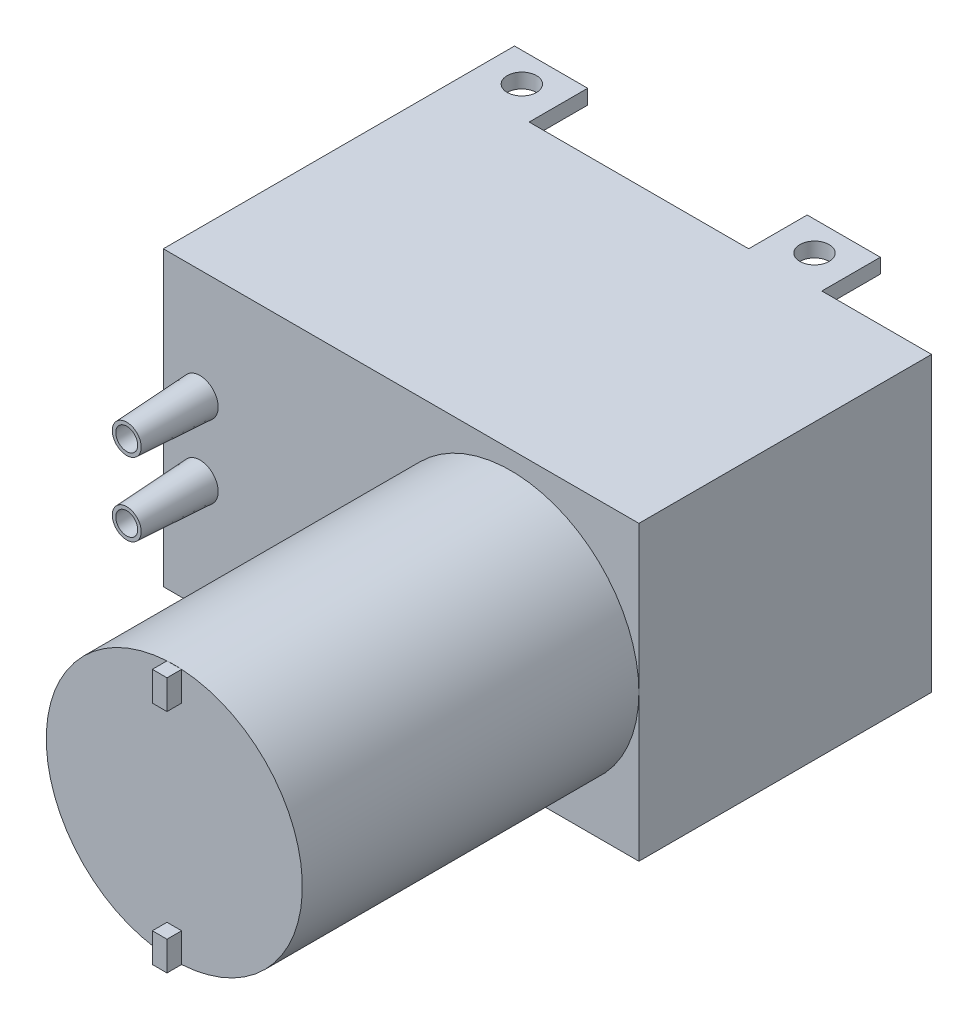
from build123d import *

# Parameters (mm, degrees)
ESQUISSE1_W                  = 65
ESQUISSE1_H                  = 40
BOSS_EXTRU_1_DEPTH           = 40
ESQUISSE2_W                  = 0.314102564
ESQUISSE2_H                  = 2.557692308
ENL_V_MAT_EXTRU_1_DEPTH      = 0.1
ESQUISSE3_R                  = 17.5
BOSS_EXTRU_2_DEPTH           = 46
ESQUISSE4_W                  = 2
ESQUISSE4_H                  = 4
BOSS_EXTRU_3_DEPTH           = 2
ESQUISSE5_R                  = 2.5
BOSS_EXTRU_4_DEPTH           = 10
BOSS_EXTRU_4_DRAFT           = 3
BOSS_EXTRU_4_PROFILE_2_DEPTH = 10
BOSS_EXTRU_4_PROFILE_2_DRAFT = 3
ESQUISSE6_R                  = 1.5
ENL_V_MAT_EXTRU_2_DEPTH      = 10
ESQUISSE7_W                  = 10
ESQUISSE7_H                  = 2
BOSS_EXTRU_5_DEPTH           = 8
ESQUISSE8_R                  = 2
ENL_V_MAT_EXTRU_3_DEPTH      = 90.29165706


with BuildPart() as part:
    # Esquisse1 → Boss.-Extru.1 (new body)
    with BuildSketch(Plane(origin=(0, 0, 0), x_dir=(1, 0, 0), z_dir=(0, 1, 0))):
        with Locations((32.5, 20)):
            Rectangle(ESQUISSE1_W, ESQUISSE1_H)
    extrude(amount=BOSS_EXTRU_1_DEPTH)

    # Esquisse2 → Enlèv. mat.-Extru.1 (cut)
    # profile 1 of 11: a face of its own
    with BuildSketch(Plane(origin=(0, 0, 0), x_dir=(1, 0, 0), z_dir=(0, 1, 0))):
        with BuildLine():
            Line((43.755423168, 24.312140482), (43.06902493, 24.312140482))
            add(Edge.make_bspline(
                [(43.06902493, 24.312140482), (43.021814024, 24.312088586), (42.931355832, 24.31198915), (42.801640776, 24.308974404), (42.683831044, 24.304947712), (42.578180663, 24.299365819), (42.484364565, 24.292769229), (42.402807266, 24.283517189), (42.332867709, 24.273856894), (42.29096126, 24.264035487), (42.27184945, 24.259556347)],
                knots=[0, 0, 0, 0, 1.415646017, 2.712440637, 3.8905458, 4.950247383, 5.884950622, 6.709939814, 7.411656543, 8, 8, 8, 8], degree=3))
            add(Edge.make_bspline(
                [(42.27184945, 24.259556347), (42.247655916, 24.252934398), (42.199838939, 24.239846536), (42.130937896, 24.213632812), (42.06538405, 24.182550647), (42.002952492, 24.147126707), (41.944410409, 24.105841143), (41.888884368, 24.060367525), (41.836864387, 24.009655957), (41.788642995, 23.954275217), (41.744358198, 23.895155007), (41.706228515, 23.831412777), (41.674301288, 23.764121474), (41.646918017, 23.693327903), (41.627209562, 23.618437579), (41.612362662, 23.539970867), (41.602939035, 23.457936177), (41.602036473, 23.401876309), (41.601577014, 23.373338399)],
                knots=[0, 0, 0, 0, 0.999701418, 1.975846123, 2.934577507, 3.890451536, 4.834027766, 5.787354733, 6.749476667, 7.726910423, 8.712836071, 9.690891519, 10.682875813, 11.679750201, 12.712814741, 13.765529915, 14.8625177, 16, 16, 16, 16], degree=3))
            add(Edge.make_bspline(
                [(41.601577014, 23.373338399), (41.601998439, 23.344560622), (41.602822984, 23.288254958), (41.61271927, 23.20588217), (41.626049461, 23.12716378), (41.646546514, 23.052274329), (41.673392187, 22.981658559), (41.70488424, 22.914237327), (41.74286777, 22.851157655), (41.7865126, 22.792190537), (41.835064194, 22.737280625), (41.888317132, 22.68682583), (41.946056425, 22.641121492), (42.008098573, 22.600065148), (42.075048422, 22.564608869), (42.145890575, 22.532851564), (42.221240792, 22.506180503), (42.273383306, 22.492150442), (42.299894321, 22.485017085)],
                knots=[0, 0, 0, 0, 1.121902311, 2.195077645, 3.232258892, 4.234102512, 5.217864754, 6.176164875, 7.132989551, 8.084763148, 9.034132444, 9.988522005, 10.94243251, 11.903244335, 12.886203696, 13.894208494, 14.929344452, 16, 16, 16, 16], degree=3))
            add(Edge.make_bspline(
                [(42.299894321, 22.485017085), (42.321821655, 22.480354103), (42.369876683, 22.470134909), (42.449019405, 22.458726452), (42.541164791, 22.448988852), (42.646187071, 22.441687714), (42.763991976, 22.435437346), (42.894643233, 22.430469252), (43.03839731, 22.427739398), (43.138668554, 22.427598605), (43.191020123, 22.427525097)],
                knots=[0, 0, 0, 0, 0.601384939, 1.31797006, 2.144135048, 3.087295005, 4.142315834, 5.309527816, 6.595305764, 8, 8, 8, 8], degree=3))
            Line((43.191020123, 22.427525097), (43.441320604, 22.427525097))
            Line((43.441320604, 22.427525097), (43.441320604, 20.812140482))
            Line((43.441320604, 20.812140482), (43.755423168, 20.812140482))
            Line((43.755423168, 20.812140482), (43.755423168, 24.312140482))
        make_face()
        with BuildLine():
            Line((43.441320604, 23.953166123), (43.441320604, 22.786499456))
            Line((43.441320604, 22.786499456), (42.828540155, 22.778787117))
            add(Edge.make_bspline(
                [(42.828540155, 22.778787117), (42.798620229, 22.778771653), (42.740860429, 22.778741801), (42.657424206, 22.782727024), (42.580014919, 22.787327557), (42.508870343, 22.79406348), (42.443958409, 22.803584738), (42.38517088, 22.813196476), (42.332963597, 22.827101838), (42.271864395, 22.845824908), (42.203781048, 22.877757523), (42.129713499, 22.924107413), (42.066942913, 22.983188122), (42.012624616, 23.049615953), (41.969518738, 23.123515082), (41.937962746, 23.202584019), (41.919421588, 23.286011869), (41.916935395, 23.343100007), (41.915679578, 23.371936155)],
                knots=[0, 0, 0, 0, 1.160613943, 2.240541288, 3.23993089, 4.169200891, 5.011653406, 5.7853311, 6.478053781, 7.106038997, 8.262395093, 9.384106736, 10.481365981, 11.59014053, 12.70357646, 13.786202915, 14.881775077, 16, 16, 16, 16], degree=3))
            add(Edge.make_bspline(
                [(41.915679578, 23.371936155), (41.916942224, 23.400074669), (41.919452209, 23.456010551), (41.938108073, 23.537989311), (41.969457386, 23.616225016), (42.012913981, 23.689198101), (42.065655111, 23.755386905), (42.126954454, 23.812884032), (42.196667715, 23.859105735), (42.261515946, 23.888939016), (42.319117132, 23.907154292), (42.369149092, 23.919899132), (42.425639767, 23.930074739), (42.488607546, 23.938314241), (42.55756438, 23.945367703), (42.633102695, 23.95015368), (42.714936338, 23.952955136), (42.771746909, 23.953094091), (42.801196405, 23.953166123)],
                knots=[0, 0, 0, 0, 1.120700087, 2.227813068, 3.331159281, 4.466773991, 5.599788987, 6.693661531, 7.80175334, 8.91857717, 9.525282508, 10.207424825, 10.974604443, 11.810962634, 12.737642355, 13.736264703, 14.826523623, 16, 16, 16, 16], degree=3))
            Line((42.801196405, 23.953166123), (43.441320604, 23.953166123))
        make_face(mode=Mode.SUBTRACT)
    # profile 2 of 11: a face of its own
    with BuildSketch(Plane(origin=(0, 0, 0), x_dir=(1, 0, 0), z_dir=(0, 1, 0))):
        with BuildLine():
            add(Edge.make_bspline(
                [(39.737995283, 23.414704585), (39.69000401, 23.413682693), (39.595904853, 23.411679015), (39.458096967, 23.390264049), (39.326551831, 23.357516685), (39.200765639, 23.312245123), (39.082349343, 23.251563172), (38.969578099, 23.179153881), (38.86276109, 23.093371287), (38.798738061, 23.027013219), (38.766240475, 22.993330386)],
                knots=[0, 0, 0, 0, 1.054011418, 2.066658804, 3.057071809, 4.030435133, 4.997543892, 5.974964718, 6.972108034, 8, 8, 8, 8], degree=3))
            add(Edge.make_bspline(
                [(38.766240475, 22.993330386), (38.738258521, 22.9611164), (38.682836141, 22.897311858), (38.611770422, 22.793856245), (38.550548862, 22.686716144), (38.501485901, 22.574468818), (38.462800877, 22.458094146), (38.435335181, 22.337192135), (38.418998246, 22.212029788), (38.416795279, 22.12702595), (38.415679578, 22.083975418)],
                knots=[0, 0, 0, 0, 1.025258237, 2.030674902, 3.01204498, 3.988269485, 4.97094183, 5.956517959, 6.965070386, 8, 8, 8, 8], degree=3))
            add(Edge.make_bspline(
                [(38.415679578, 22.083975418), (38.416660915, 22.04067536), (38.418600084, 21.955112427), (38.4369437, 21.829093061), (38.465474786, 21.706898238), (38.506306624, 21.589039545), (38.558664733, 21.475156717), (38.622555421, 21.365747168), (38.698427038, 21.260595035), (38.784431035, 21.160593196), (38.879482911, 21.068426982), (38.982599059, 20.988098712), (39.091753093, 20.919277188), (39.208396446, 20.863840772), (39.331463933, 20.820131072), (39.461221001, 20.789431055), (39.597466071, 20.770869372), (39.690493293, 20.768485798), (39.737995283, 20.767268687)],
                knots=[0, 0, 0, 0, 0.998656419, 1.973391657, 2.932242238, 3.890759089, 4.846373663, 5.82037756, 6.809684879, 7.83454468, 8.860553229, 9.859544525, 10.845671541, 11.83227036, 12.833544569, 13.85385346, 14.904124723, 16, 16, 16, 16], degree=3))
            add(Edge.make_bspline(
                [(39.737995283, 20.767268687), (39.785730003, 20.768489883), (39.879220862, 20.770881658), (40.015946844, 20.789358941), (40.145936463, 20.820116923), (40.269165062, 20.863984416), (40.386309909, 20.91927896), (40.496096406, 20.987890649), (40.599296321, 21.068450804), (40.694368305, 21.160586741), (40.780366911, 21.260596698), (40.856239919, 21.365746736), (40.920130245, 21.47515683), (40.972488449, 21.589039515), (41.013320262, 21.706898246), (41.041851355, 21.829093059), (41.060194969, 21.955112427), (41.062134138, 22.04067536), (41.063115475, 22.083975418)],
                knots=[0, 0, 0, 0, 1.099876186, 2.154163076, 3.173186993, 4.173200201, 5.163417411, 6.152872554, 7.150605724, 8.17532212, 9.198891216, 10.186952605, 11.159729845, 12.11414092, 13.071450619, 14.029093627, 15.002601286, 16, 16, 16, 16], degree=3))
            add(Edge.make_bspline(
                [(41.063115475, 22.083975418), (41.061992165, 22.126791964), (41.059768204, 22.211561366), (41.043447694, 22.336488427), (41.016089138, 22.457185816), (40.977357742, 22.573111292), (40.927842551, 22.684866728), (40.867481263, 22.792271559), (40.79569063, 22.895259359), (40.740488679, 22.958981439), (40.712554578, 22.99122702)],
                knots=[0, 0, 0, 0, 1.031353054, 2.041901799, 3.029428768, 4.008703097, 4.981709435, 5.96992636, 6.972712378, 8, 8, 8, 8], degree=3))
            add(Edge.make_bspline(
                [(40.712554578, 22.99122702), (40.680105987, 23.02520196), (40.616290123, 23.092019656), (40.508941395, 23.17755218), (40.396447574, 23.251468254), (40.276722648, 23.310944469), (40.15103979, 23.357782987), (40.018820548, 23.390348502), (39.880545032, 23.411601857), (39.785985411, 23.413660035), (39.737995283, 23.414704585)],
                knots=[0, 0, 0, 0, 1.027980169, 2.021703884, 2.998553061, 3.971491411, 4.943284454, 5.930300938, 6.949603206, 8, 8, 8, 8], degree=3))
        make_face()
        with BuildLine():
            add(Edge.make_bspline(
                [(39.739397527, 23.10060202), (39.773335138, 23.099637429), (39.840334267, 23.097733146), (39.938953851, 23.083249241), (40.033894005, 23.060301737), (40.125334849, 23.027697681), (40.212968022, 22.985598782), (40.296877424, 22.933890422), (40.377309864, 22.873257466), (40.452691927, 22.803794794), (40.52187424, 22.727915799), (40.582352216, 22.647067441), (40.633777323, 22.562561094), (40.676617482, 22.474308883), (40.70852467, 22.381416469), (40.731697692, 22.284935838), (40.746167933, 22.184670422), (40.748054311, 22.116509403), (40.749012911, 22.081872052)],
                knots=[0, 0, 0, 0, 1.021534396, 2.016698045, 2.994645724, 3.958388632, 4.93408049, 5.916473867, 6.921342795, 7.962252576, 8.998418191, 10.008913653, 10.997312074, 11.973003931, 12.956656626, 13.948281152, 14.957379055, 16, 16, 16, 16], degree=3))
            add(Edge.make_bspline(
                [(40.749012911, 22.081872052), (40.747406088, 22.037120025), (40.744216843, 21.94829562), (40.718281607, 21.817484497), (40.674895327, 21.691902645), (40.616308047, 21.572286259), (40.542901828, 21.461613981), (40.456414762, 21.362942497), (40.357775061, 21.277756685), (40.248158561, 21.20707584), (40.129804243, 21.150916084), (40.004547922, 21.111117108), (39.873907228, 21.085245416), (39.784626497, 21.082673941), (39.739397527, 21.081371251)],
                knots=[0, 0, 0, 0, 1.016792936, 2.018143844, 3.017858371, 4.030088057, 5.03801393, 6.028138512, 7.003788237, 7.991172063, 8.984598303, 9.972568034, 10.972917682, 12, 12, 12, 12], degree=3))
            add(Edge.make_bspline(
                [(39.739397527, 21.081371251), (39.694171158, 21.082681531), (39.604895562, 21.085267988), (39.474436385, 21.110986808), (39.349522413, 21.151090469), (39.231291025, 21.207012679), (39.121724422, 21.278025093), (39.022375301, 21.36246147), (38.93662669, 21.461875322), (38.863293085, 21.572432851), (38.803746342, 21.691717203), (38.76056314, 21.817507675), (38.734565554, 21.948289717), (38.731384726, 22.037118048), (38.729782142, 22.081872052)],
                knots=[0, 0, 0, 0, 1.02726834, 2.027799167, 3.010890988, 4.004497153, 4.992059811, 5.971914811, 6.958719428, 7.966827853, 8.981595046, 9.981490638, 10.983022906, 12, 12, 12, 12], degree=3))
            add(Edge.make_bspline(
                [(38.729782142, 22.081872052), (38.730740412, 22.11650961), (38.732626141, 22.184671036), (38.747101106, 22.284933489), (38.770256645, 22.381425086), (38.802228262, 22.474277089), (38.844882276, 22.562789594), (38.897299069, 22.646819321), (38.957530095, 22.728195867), (39.027547216, 22.803549508), (39.102850594, 22.873284544), (39.183315632, 22.933913934), (39.26710061, 22.985371529), (39.354479193, 23.02805777), (39.445931761, 23.06000511), (39.54073889, 23.083381741), (39.6389377, 23.097671938), (39.705696743, 23.09961908), (39.739397527, 23.10060202)],
                knots=[0, 0, 0, 0, 1.042956736, 2.052379634, 3.044323526, 4.02829302, 5.004299113, 5.996692471, 7.007513377, 8.048758398, 9.090003419, 10.095195979, 11.07790575, 12.047570684, 13.018257071, 13.989683339, 14.985167495, 16, 16, 16, 16], degree=3))
        make_face(mode=Mode.SUBTRACT)
    # profile 3 of 11: a face of its own
    with BuildSketch(Plane(origin=(0, 0, 0), x_dir=(1, 0, 0), z_dir=(0, 1, 0))):
        with BuildLine():
            Line((37.78747445, 23.36983279), (37.473371886, 23.36983279))
            Line((37.473371886, 23.36983279), (37.473371886, 22.925321572))
            add(Edge.make_bspline(
                [(37.473371886, 22.925321572), (37.445087936, 22.964209173), (37.390893176, 23.038721547), (37.302027524, 23.136911831), (37.213251411, 23.220239985), (37.149318029, 23.263982857), (37.118604257, 23.284997052)],
                knots=[0, 0, 0, 0, 1.134379233, 2.173579362, 3.122582517, 4, 4, 4, 4], degree=3))
            add(Edge.make_bspline(
                [(37.118604257, 23.284997052), (37.076739595, 23.305002418), (36.993741695, 23.344663631), (36.862322471, 23.38489719), (36.727847801, 23.409622291), (36.637039587, 23.413003665), (36.591360668, 23.414704585)],
                knots=[0, 0, 0, 0, 1.014936303, 2.012140481, 3.000054389, 4, 4, 4, 4], degree=3))
            add(Edge.make_bspline(
                [(36.591360668, 23.414704585), (36.560467671, 23.413659294), (36.499332092, 23.41159072), (36.408748002, 23.398130684), (36.32088939, 23.374864511), (36.236275361, 23.342457187), (36.156554682, 23.3032105), (36.083465484, 23.257160793), (36.017841276, 23.205463717), (35.959715224, 23.145784784), (35.907446199, 23.076448186), (35.859367352, 22.995583937), (35.81494214, 22.901376276), (35.790320831, 22.833009735), (35.777358264, 22.797016283)],
                knots=[0, 0, 0, 0, 1.009824226, 1.998387844, 2.986035974, 3.974953746, 4.955485308, 5.885931332, 6.793869504, 7.679848016, 8.601185859, 9.625726857, 10.749998409, 12, 12, 12, 12], degree=3))
            add(Edge.make_bspline(
                [(35.777358264, 22.797016283), (35.763647012, 22.821740703), (35.736665195, 22.870394887), (35.691359558, 22.93925315), (35.643891762, 23.003659942), (35.593857269, 23.063666366), (35.541432682, 23.118976096), (35.486371282, 23.169771998), (35.4289865, 23.216272212), (35.34919426, 23.270595371), (35.245381653, 23.328296553), (35.114493538, 23.378324997), (34.978343367, 23.409241125), (34.885925668, 23.412871398), (34.839257302, 23.414704585)],
                knots=[0, 0, 0, 0, 0.86119277, 1.694706429, 2.50939023, 3.298075842, 4.073795165, 4.829715201, 5.57930267, 6.321991688, 7.768977793, 9.186738141, 10.579381044, 12, 12, 12, 12], degree=3))
            add(Edge.make_bspline(
                [(34.839257302, 23.414704585), (34.796375839, 23.413087364), (34.712452653, 23.409922305), (34.590275387, 23.385068832), (34.476333582, 23.342391185), (34.370856506, 23.284157548), (34.275696693, 23.210978365), (34.192980383, 23.123909527), (34.12321002, 23.023566904), (34.07763138, 22.929174916), (34.046716116, 22.845839583), (34.027654882, 22.774833292), (34.010815187, 22.696681739), (33.996833941, 22.611291477), (33.986615389, 22.518360869), (33.979044674, 22.418041993), (33.9739206, 22.310256881), (33.973558528, 22.235891381), (33.973371886, 22.197557149)],
                knots=[0, 0, 0, 0, 1.209669288, 2.367440248, 3.500751976, 4.631527125, 5.755587489, 6.87532382, 8.007944318, 9.190864318, 9.82315674, 10.514484317, 11.263564316, 12.079023757, 12.955305781, 13.901327259, 14.918167583, 16, 16, 16, 16], degree=3))
            Line((33.973371886, 22.197557149), (33.973371886, 20.812140482))
            Line((33.973371886, 20.812140482), (34.28747445, 20.812140482))
            Line((34.28747445, 20.812140482), (34.28747445, 22.198959392))
            add(Edge.make_bspline(
                [(34.28747445, 22.198959392), (34.287552333, 22.231679966), (34.287702012, 22.294563933), (34.290395643, 22.384816384), (34.295470958, 22.467084741), (34.301405596, 22.54125683), (34.309649406, 22.607505618), (34.320295337, 22.665698037), (34.331573017, 22.716291848), (34.350309008, 22.772377896), (34.3802569, 22.834248106), (34.42587438, 22.900971682), (34.483344486, 22.959052482), (34.549704643, 23.009470799), (34.625253088, 23.05046444), (34.708517811, 23.07974045), (34.798981862, 23.097863328), (34.861604651, 23.099669344), (34.893944802, 23.10060202)],
                knots=[0, 0, 0, 0, 1.253487763, 2.409012846, 3.458416907, 4.410876679, 5.259312806, 6.014470957, 6.676830364, 7.243083969, 8.276244668, 9.299465089, 10.325150304, 11.392391894, 12.482080715, 13.603491619, 14.762376348, 16, 16, 16, 16], degree=3))
            add(Edge.make_bspline(
                [(34.893944802, 23.10060202), (34.933614757, 23.099185863), (35.012017668, 23.096386998), (35.126463154, 23.067813125), (35.236434171, 23.024732874), (35.338649304, 22.962300417), (35.432677094, 22.887492053), (35.513576672, 22.798542457), (35.580408858, 22.69791253), (35.625662834, 22.604765828), (35.654252135, 22.521096384), (35.673129051, 22.447999012), (35.687812442, 22.364917444), (35.701582971, 22.272409953), (35.710570699, 22.169839773), (35.718739072, 22.057681372), (35.722559934, 21.935597413), (35.723094393, 21.850970724), (35.723371886, 21.807032309)],
                knots=[0, 0, 0, 0, 1.090531906, 2.155305635, 3.229839962, 4.33261226, 5.44038871, 6.529323825, 7.629011124, 8.757537029, 9.370236727, 10.061839251, 10.834451254, 11.692844982, 12.636905849, 13.66920014, 14.789842145, 16, 16, 16, 16], degree=3))
            Line((35.723371886, 21.807032309), (35.723371886, 20.812140482))
            Line((35.723371886, 20.812140482), (36.03747445, 20.812140482))
            Line((36.03747445, 20.812140482), (36.03747445, 22.112721411))
            add(Edge.make_bspline(
                [(36.03747445, 22.112721411), (36.037553881, 22.14941473), (36.037706698, 22.220008987), (36.040383015, 22.321242663), (36.045469637, 22.413323743), (36.051350185, 22.496145207), (36.059810364, 22.569556535), (36.069420126, 22.633951293), (36.080768736, 22.689168044), (36.099558621, 22.749731429), (36.128273089, 22.816452352), (36.174461351, 22.887593374), (36.232068932, 22.949861471), (36.299639808, 23.003020219), (36.37564549, 23.046961701), (36.459628891, 23.078621453), (36.550833803, 23.097045742), (36.613711509, 23.099394239), (36.646048168, 23.10060202)],
                knots=[0, 0, 0, 0, 1.320475261, 2.540461679, 3.643808994, 4.639130445, 5.527981419, 6.302341397, 6.981980563, 7.553956391, 8.582137848, 9.585246428, 10.591171744, 11.620968678, 12.668337649, 13.738356861, 14.836885341, 16, 16, 16, 16], degree=3))
            add(Edge.make_bspline(
                [(36.646048168, 23.10060202), (36.684064379, 23.09907156), (36.759829339, 23.096021408), (36.871131308, 23.068567134), (36.978616992, 23.025563059), (37.080571691, 22.96590324), (37.174245839, 22.892004162), (37.256254106, 22.805089266), (37.325196632, 22.706240232), (37.370928447, 22.614075716), (37.400426921, 22.532502441), (37.420022255, 22.463151493), (37.436861881, 22.386151245), (37.449375903, 22.301264134), (37.461456319, 22.20904304), (37.467286628, 22.10902855), (37.47295819, 22.001306462), (37.473230604, 21.926933917), (37.473371886, 21.888362437)],
                knots=[0, 0, 0, 0, 1.098833095, 2.189935336, 3.297829714, 4.440610912, 5.596351641, 6.740013378, 7.886572111, 9.072425424, 9.705826452, 10.395263256, 11.156850408, 11.985370555, 12.878090359, 13.847760091, 14.883794034, 16, 16, 16, 16], degree=3))
            Line((37.473371886, 21.888362437), (37.473371886, 20.812140482))
            Line((37.473371886, 20.812140482), (37.78747445, 20.812140482))
            Line((37.78747445, 20.812140482), (37.78747445, 23.36983279))
        make_face()
    # profile 4 of 11: a face of its own
    with BuildSketch(Plane(origin=(0, 0, 0), x_dir=(1, 0, 0), z_dir=(0, 1, 0))):
        with BuildLine():
            Line((33.255423168, 23.36983279), (32.941320604, 23.36983279))
            Line((32.941320604, 23.36983279), (32.941320604, 22.896575578))
            add(Edge.make_bspline(
                [(32.941320604, 22.896575578), (32.907963119, 22.939513312), (32.843139525, 23.022954205), (32.73141462, 23.130944333), (32.613487811, 23.222019637), (32.486324399, 23.29340217), (32.351900708, 23.347222982), (32.210768391, 23.387002432), (32.061729626, 23.410443906), (31.959833173, 23.413265568), (31.907867078, 23.414704585)],
                knots=[0, 0, 0, 0, 1.0828784, 2.104357462, 3.088488658, 4.04616522, 5.001424249, 5.969181776, 6.964304535, 8, 8, 8, 8], degree=3))
            add(Edge.make_bspline(
                [(31.907867078, 23.414704585), (31.862475475, 23.413391406), (31.772756586, 23.410795839), (31.640693357, 23.393222784), (31.513517974, 23.363105092), (31.39194992, 23.319704176), (31.274686855, 23.266048706), (31.163464755, 23.198331671), (31.056551199, 23.11992548), (30.95663501, 23.029693329), (30.864313643, 22.932065063), (30.784467462, 22.827042759), (30.715595557, 22.718080172), (30.659925261, 22.60348808), (30.616316913, 22.48416885), (30.585302236, 22.359640409), (30.566844592, 22.230364469), (30.564368141, 22.142461748), (30.563115475, 22.097997854)],
                knots=[0, 0, 0, 0, 1.041296284, 2.058176809, 3.050446431, 4.034000596, 5.01514041, 6.003636468, 7.015969324, 8.052561599, 9.08815499, 10.094063707, 11.074456064, 12.040834395, 13.011057502, 13.983766392, 14.980127149, 16, 16, 16, 16], degree=3))
            add(Edge.make_bspline(
                [(30.563115475, 22.097997854), (30.564340961, 22.052595545), (30.566757795, 21.963055641), (30.585502801, 21.831568543), (30.615459675, 21.70508117), (30.658517858, 21.583803906), (30.714159347, 21.467820255), (30.781863907, 21.357213859), (30.861750374, 21.252020156), (30.953051502, 21.153667256), (31.052104438, 21.063067943), (31.157981928, 20.983829873), (31.269040853, 20.917288498), (31.38471302, 20.861705538), (31.505988659, 20.819813354), (31.632301936, 20.789595553), (31.763584083, 20.770961058), (31.852885235, 20.768508915), (31.898051373, 20.767268687)],
                knots=[0, 0, 0, 0, 1.038740735, 2.04854663, 3.033179607, 4.009277356, 4.987731542, 5.972001279, 6.972200261, 8.005528982, 9.039189865, 10.040446548, 11.026516639, 11.997840187, 12.972163198, 13.956796175, 14.96660207, 16, 16, 16, 16], degree=3))
            add(Edge.make_bspline(
                [(31.898051373, 20.767268687), (31.948878945, 20.768563495), (32.049278301, 20.77112112), (32.196075971, 20.79704053), (32.337352823, 20.835777465), (32.471543648, 20.892476459), (32.59971146, 20.964731975), (32.721131266, 21.052842181), (32.836448019, 21.156622806), (32.905856776, 21.235354622), (32.941320604, 21.275581988)],
                knots=[0, 0, 0, 0, 1.014726462, 2.004382257, 2.969841629, 3.936926163, 4.907207904, 5.903978561, 6.929055279, 8, 8, 8, 8], degree=3))
            Line((32.941320604, 21.275581988), (32.941320604, 19.86983279))
            Line((32.941320604, 19.86983279), (33.255423168, 19.86983279))
            Line((33.255423168, 19.86983279), (33.255423168, 23.36983279))
        make_face()
        with BuildLine():
            add(Edge.make_bspline(
                [(31.910671565, 23.10060202), (31.946251128, 23.099961762), (32.016298115, 23.098701259), (32.118970334, 23.08372731), (32.217865762, 23.061989569), (32.311987713, 23.029077669), (32.40223833, 22.988678855), (32.487922495, 22.938196844), (32.568980062, 22.878544838), (32.645207093, 22.810865494), (32.714070386, 22.736290806), (32.775033314, 22.656702997), (32.826240619, 22.572202858), (32.868742639, 22.483577495), (32.901085922, 22.39013221), (32.924041642, 22.292399197), (32.938471995, 22.190271485), (32.940360932, 22.120715478), (32.941320604, 22.085377661)],
                knots=[0, 0, 0, 0, 1.05670511, 2.080379991, 3.077984906, 4.06214886, 5.038337365, 6.01289324, 7.01187578, 8.025460281, 9.038092164, 10.024533457, 11.000252242, 11.969694649, 12.940728589, 13.933144304, 14.949937299, 16, 16, 16, 16], degree=3))
            add(Edge.make_bspline(
                [(32.941320604, 22.085377661), (32.939729747, 22.038989549), (32.936613126, 21.948111308), (32.911275758, 21.815327186), (32.870040494, 21.68967553), (32.81151178, 21.572214493), (32.737564206, 21.464231658), (32.648466049, 21.367541052), (32.545023498, 21.282750461), (32.428956307, 21.211329207), (32.304534176, 21.153341141), (32.174748264, 21.11182693), (32.041383383, 21.086254702), (31.951215063, 21.083007883), (31.905763713, 21.081371251)],
                knots=[0, 0, 0, 0, 1.03728447, 2.032128127, 3.01272805, 3.987917167, 4.958271349, 5.931593992, 6.91984656, 7.941419022, 8.973179163, 9.983609215, 10.983593296, 12, 12, 12, 12], degree=3))
            add(Edge.make_bspline(
                [(31.905763713, 21.081371251), (31.861227945, 21.082927628), (31.772832452, 21.086016756), (31.64267433, 21.112754944), (31.516183692, 21.153599969), (31.396003519, 21.213159525), (31.283180031, 21.286149583), (31.181298478, 21.373709616), (31.092291564, 21.475199559), (31.016427209, 21.588208062), (30.955295724, 21.709383446), (30.909365484, 21.834764835), (30.882856911, 21.963910258), (30.879100122, 22.050907971), (30.877218039, 22.094492245)],
                knots=[0, 0, 0, 0, 1.00104056, 1.986885549, 2.97790532, 3.984399681, 4.995088187, 5.994304198, 6.996462723, 8.023150851, 9.048424203, 10.043036403, 11.019596776, 12, 12, 12, 12], degree=3))
            add(Edge.make_bspline(
                [(30.877218039, 22.094492245), (30.878672773, 22.138347234), (30.881570907, 22.225715538), (30.910117945, 22.354478441), (30.953017923, 22.480366417), (31.015576974, 22.599886966), (31.089778244, 22.712661049), (31.179525241, 22.812214928), (31.280141437, 22.899385601), (31.392830601, 22.971401011), (31.513771027, 23.028686506), (31.641085943, 23.070570145), (31.774129545, 23.095743894), (31.8647572, 23.0989684), (31.910671565, 23.10060202)],
                knots=[0, 0, 0, 0, 0.983928682, 1.960191568, 2.949917689, 3.96440592, 4.982380491, 5.975291189, 6.965713506, 7.964880129, 8.970154049, 9.96478489, 10.968906225, 12, 12, 12, 12], degree=3))
        make_face(mode=Mode.SUBTRACT)
    # profile 5 of 11: a face of its own
    with BuildSketch(Plane(origin=(0, 0, 0), x_dir=(1, 0, 0), z_dir=(0, 1, 0))):
        with BuildLine():
            Line((27.835751693, 21.61983279), (27.556705219, 21.473298335))
            add(Edge.make_bspline(
                [(27.556705219, 21.473298335), (27.578941814, 21.433855003), (27.622205423, 21.3571139), (27.696606171, 21.25168204), (27.774598243, 21.156834324), (27.859702211, 21.07510467), (27.94937189, 21.003853285), (28.044104545, 20.94151546), (28.144393363, 20.88839694), (28.250243087, 20.843644412), (28.362542639, 20.809234918), (28.481564155, 20.784930697), (28.60753565, 20.769907428), (28.69388183, 20.768162287), (28.738095443, 20.767268687)],
                knots=[0, 0, 0, 0, 1.120438281, 2.179929193, 3.190490725, 4.156257408, 5.095198341, 6.022838206, 6.959905092, 7.901321166, 8.864066838, 9.862729781, 10.905609505, 12, 12, 12, 12], degree=3))
            add(Edge.make_bspline(
                [(28.738095443, 20.767268687), (28.787237421, 20.768415862), (28.883099182, 20.770653669), (29.02263893, 20.789946134), (29.154018348, 20.821418492), (29.277230051, 20.865384034), (29.391972304, 20.922811358), (29.498473159, 20.99277084), (29.597292685, 21.074903094), (29.685316894, 21.169919538), (29.764560777, 21.271601495), (29.834486596, 21.37755738), (29.892944028, 21.487520604), (29.940496638, 21.600791128), (29.978901503, 21.716655022), (30.005668206, 21.836166489), (30.021097954, 21.959002074), (30.0234624, 22.042099409), (30.024653937, 22.083975418)],
                knots=[0, 0, 0, 0, 1.145258523, 2.234067595, 3.276747158, 4.290159414, 5.277019952, 6.260822364, 7.254936242, 8.264827045, 9.274100331, 10.257902744, 11.220704747, 12.172965371, 13.118907548, 14.062713208, 15.023725156, 16, 16, 16, 16], degree=3))
            add(Edge.make_bspline(
                [(30.024653937, 22.083975418), (30.023594796, 22.123270248), (30.021495717, 22.201147413), (30.00826493, 22.316412958), (29.984816637, 22.42844141), (29.952640313, 22.537325858), (29.911089067, 22.642883992), (29.860256847, 22.745180056), (29.80006447, 22.844105195), (29.753591796, 22.906508329), (29.730182783, 22.937941764)],
                knots=[0, 0, 0, 0, 1.024358464, 2.0301432, 3.019427413, 4.004406732, 4.986367066, 5.972626655, 6.978780325, 8, 8, 8, 8], degree=3))
            add(Edge.make_bspline(
                [(29.730182783, 22.937941764), (29.6984751, 22.975810634), (29.636064154, 23.050348785), (29.530507798, 23.14828711), (29.416207602, 23.230330886), (29.294595976, 23.298338022), (29.164259502, 23.350011669), (29.026950211, 23.388519251), (28.881104625, 23.410097262), (28.781399404, 23.413145096), (28.730383104, 23.414704585)],
                knots=[0, 0, 0, 0, 1.030682036, 2.02871468, 2.997146059, 3.962720338, 4.930598197, 5.918074684, 6.934738563, 8, 8, 8, 8], degree=3))
            add(Edge.make_bspline(
                [(28.730383104, 23.414704585), (28.677935498, 23.413350536), (28.575045252, 23.4106942), (28.425013131, 23.386067867), (28.283052415, 23.347015312), (28.14921991, 23.291861522), (28.02350205, 23.22070197), (27.906716, 23.132560129), (27.796864488, 23.030142041), (27.732955909, 22.951378832), (27.700435187, 22.911299136)],
                knots=[0, 0, 0, 0, 1.056321875, 2.072262726, 3.055038591, 4.01806755, 4.982017516, 5.957941055, 6.960871419, 8, 8, 8, 8], degree=3))
            add(Edge.make_bspline(
                [(27.700435187, 22.911299136), (27.678308249, 22.881095554), (27.634201655, 22.820889436), (27.578954555, 22.722718279), (27.53099716, 22.620007684), (27.492664199, 22.511097387), (27.461624698, 22.397277807), (27.43916788, 22.277735262), (27.425998261, 22.152505351), (27.423409564, 22.067178795), (27.422089834, 22.023678944)],
                knots=[0, 0, 0, 0, 0.94817472, 1.890038105, 2.849395472, 3.817997239, 4.812318967, 5.836947057, 6.897266129, 8, 8, 8, 8], degree=3))
            Line((27.422089834, 22.023678944), (29.710551373, 22.023678944))
            add(Edge.make_bspline(
                [(29.710551373, 22.023678944), (29.709011766, 21.989978479), (29.705984192, 21.923707876), (29.691869049, 21.826737092), (29.669620275, 21.73436375), (29.638351213, 21.647280708), (29.600484368, 21.564350581), (29.554098651, 21.486188544), (29.498759097, 21.413150614), (29.437033397, 21.344583476), (29.368326302, 21.283522715), (29.296043555, 21.228870939), (29.21914999, 21.183065342), (29.138251906, 21.145885452), (29.053480121, 21.116779136), (28.964807926, 21.096911316), (28.87240981, 21.083604209), (28.809424076, 21.082124543), (28.777358264, 21.081371251)],
                knots=[0, 0, 0, 0, 1.094153842, 2.151609401, 3.174256925, 4.172055639, 5.149267565, 6.128595816, 7.11444997, 8.118368179, 9.117203808, 10.09244225, 11.054858984, 12.015122123, 12.976791628, 13.957293641, 14.960065497, 16, 16, 16, 16], degree=3))
            add(Edge.make_bspline(
                [(28.777358264, 21.081371251), (28.746007116, 21.081979308), (28.683800425, 21.083185809), (28.591159568, 21.09491772), (28.500020041, 21.113887995), (28.410759057, 21.139777986), (28.325188211, 21.171354838), (28.245942661, 21.209457695), (28.173062446, 21.251607442), (28.104945479, 21.299817117), (28.038874486, 21.358825304), (27.973331999, 21.432461025), (27.903055346, 21.519548553), (27.859065753, 21.585094219), (27.835751693, 21.61983279)],
                knots=[0, 0, 0, 0, 0.99110716, 1.966546729, 2.947904876, 3.932708344, 4.903319531, 5.828989031, 6.710028674, 7.56322171, 8.463672341, 9.504779593, 10.677557249, 12, 12, 12, 12], degree=3))
        make_face()
        with BuildLine():
            add(Edge.make_bspline(
                [(27.736192398, 22.337781508), (27.747689023, 22.379444381), (27.769816324, 22.459632002), (27.816052689, 22.570672892), (27.86812423, 22.669360793), (27.929745961, 22.754940426), (27.999564687, 22.830943939), (28.080209869, 22.897362525), (28.170645763, 22.956779976), (28.270404903, 23.006932475), (28.376046688, 23.049622334), (28.48665288, 23.07824745), (28.599510668, 23.097856992), (28.675844955, 23.0996831), (28.714257302, 23.10060202)],
                knots=[0, 0, 0, 0, 1.154881502, 2.222775134, 3.210006277, 4.132804581, 5.035138423, 5.962687519, 6.919655026, 7.923214229, 8.944639381, 9.960483929, 10.97369054, 12, 12, 12, 12], degree=3))
            add(Edge.make_bspline(
                [(28.714257302, 23.10060202), (28.745606741, 23.099990349), (28.80757799, 23.098781203), (28.898879058, 23.087311074), (28.986558757, 23.068351229), (29.071264045, 23.042386272), (29.151884913, 23.00777767), (29.230079681, 22.967194443), (29.303860077, 22.917652859), (29.350001373, 22.879894004), (29.373311789, 22.860818367)],
                knots=[0, 0, 0, 0, 1.04873581, 2.073130211, 3.073294108, 4.04793562, 5.032784715, 6.005352987, 6.992311501, 8, 8, 8, 8], degree=3))
            add(Edge.make_bspline(
                [(29.373311789, 22.860818367), (29.390005071, 22.845724051), (29.423788206, 22.815176835), (29.468928727, 22.762547628), (29.5121492, 22.705796066), (29.551482853, 22.642750942), (29.587560439, 22.574130163), (29.621320416, 22.500512527), (29.651706828, 22.421339397), (29.668802938, 22.366166958), (29.677598648, 22.337781508)],
                knots=[0, 0, 0, 0, 0.879870761, 1.780643979, 2.707998968, 3.669668524, 4.684282772, 5.740141944, 6.837334558, 8, 8, 8, 8], degree=3))
            Line((29.677598648, 22.337781508), (27.736192398, 22.337781508))
        make_face(mode=Mode.SUBTRACT)
    # profile 6 of 11: a face of its own
    with BuildSketch(Plane(origin=(0, 0, 0), x_dir=(1, 0, 0), z_dir=(0, 1, 0))):
        with BuildLine():
            Line((22.845166757, 23.36983279), (22.845166757, 20.812140482))
            Line((22.845166757, 20.812140482), (23.159269321, 20.812140482))
            Line((23.159269321, 20.812140482), (23.159269321, 21.254548335))
            add(Edge.make_bspline(
                [(23.159269321, 21.254548335), (23.194688112, 21.214508741), (23.263808327, 21.136370969), (23.379249445, 21.034288797), (23.501617623, 20.949910475), (23.630318944, 20.88176056), (23.765237188, 20.830568503), (23.906073275, 20.794182344), (24.052884656, 20.770788509), (24.153137011, 20.768452487), (24.203940796, 20.767268687)],
                knots=[0, 0, 0, 0, 1.074387032, 2.096679803, 3.090159297, 4.057316773, 5.018401886, 5.985159533, 6.978961417, 8, 8, 8, 8], degree=3))
            add(Edge.make_bspline(
                [(24.203940796, 20.767268687), (24.24910875, 20.768495059), (24.338181955, 20.77091352), (24.469211032, 20.789675823), (24.595303281, 20.819806445), (24.716577854, 20.861707335), (24.832249999, 20.917288156), (24.943310096, 20.983829404), (25.049182788, 21.063070234), (25.148254327, 21.153658263), (25.239486327, 21.25205325), (25.3195476, 21.356998797), (25.38630068, 21.468041101), (25.44212076, 21.583774254), (25.485117105, 21.705089174), (25.515090739, 21.831566342), (25.533831186, 21.963056216), (25.536248647, 22.052595739), (25.53747445, 22.097997854)],
                knots=[0, 0, 0, 0, 1.033919861, 2.038935746, 3.024066025, 3.998881131, 4.97069526, 5.957263378, 6.95902576, 7.993208707, 9.027059324, 10.027763471, 11.009749337, 11.988697705, 12.965288445, 13.950418724, 14.960734635, 16, 16, 16, 16], degree=3))
            add(Edge.make_bspline(
                [(25.53747445, 22.097997854), (25.536221478, 22.142461557), (25.533744421, 22.230363901), (25.515291202, 22.359642599), (25.484260193, 22.484160859), (25.440712345, 22.603517803), (25.38487039, 22.717857853), (25.316942303, 22.827261878), (25.236923179, 22.932031275), (25.144670772, 23.029702502), (25.044736001, 23.119923116), (24.937827271, 23.198332162), (24.826603989, 23.266049011), (24.709340979, 23.319702487), (24.587773874, 23.363111591), (24.460820428, 23.39314456), (24.329008849, 23.410841881), (24.239518357, 23.413404645), (24.194125091, 23.414704585)],
                knots=[0, 0, 0, 0, 1.020392517, 2.01726096, 2.990465484, 3.961182959, 4.928053699, 5.906110375, 6.912531644, 7.948652711, 8.985773172, 9.998621852, 10.987621588, 11.969261332, 12.953316658, 13.946091881, 14.958173133, 16, 16, 16, 16], degree=3))
            add(Edge.make_bspline(
                [(24.194125091, 23.414704585), (24.141925232, 23.413266833), (24.039563772, 23.41044747), (23.889835762, 23.386984743), (23.748191285, 23.347346276), (23.613536932, 23.293428778), (23.486356246, 23.221780049), (23.367853262, 23.131400087), (23.256787779, 23.022858901), (23.192407487, 22.939488456), (23.159269321, 22.896575578)],
                knots=[0, 0, 0, 0, 1.038897134, 2.037228247, 3.008116434, 3.962042015, 4.918381754, 5.904844433, 6.921570401, 8, 8, 8, 8], degree=3))
            Line((23.159269321, 22.896575578), (23.159269321, 23.36983279))
            Line((23.159269321, 23.36983279), (22.845166757, 23.36983279))
        make_face()
        with BuildLine():
            add(Edge.make_bspline(
                [(24.18991836, 23.10060202), (24.235832698, 23.098968383), (24.326460298, 23.095743842), (24.4595043, 23.070570346), (24.586817714, 23.028685752), (24.707763788, 22.971403851), (24.820432005, 22.899375114), (24.921125676, 22.812253731), (25.010668377, 22.712416717), (25.085976641, 22.600314607), (25.147367138, 22.480136515), (25.19053417, 22.354512077), (25.219003418, 22.2257071), (25.221911938, 22.138344414), (25.223371886, 22.094492245)],
                knots=[0, 0, 0, 0, 1.031046209, 2.035121221, 3.029706178, 4.034933723, 5.034054252, 6.02443088, 7.017295772, 8.038157696, 9.050218397, 10.03989886, 11.016116709, 12, 12, 12, 12], degree=3))
            add(Edge.make_bspline(
                [(25.223371886, 22.094492245), (25.221506992, 22.050902138), (25.217784515, 21.963892782), (25.191033821, 21.834912205), (25.146153948, 21.709258163), (25.084911885, 21.587997169), (25.00822526, 21.475413069), (24.919336608, 21.373672946), (24.817386326, 21.286183358), (24.704458819, 21.212945785), (24.583850849, 21.153783264), (24.457016917, 21.112617624), (24.326341279, 21.086039844), (24.237488945, 21.082935367), (24.192722847, 21.081371251)],
                knots=[0, 0, 0, 0, 0.979072187, 1.954306742, 2.945804271, 3.96968567, 4.997920485, 5.998718438, 6.996577872, 8.005894225, 9.015743152, 10.005417472, 10.995077863, 12, 12, 12, 12], degree=3))
            add(Edge.make_bspline(
                [(24.192722847, 21.081371251), (24.147276344, 21.083031215), (24.056887758, 21.086332719), (23.92344905, 21.111613984), (23.793954087, 21.153382782), (23.670166859, 21.211281909), (23.554850728, 21.283039265), (23.45135285, 21.367046356), (23.363836882, 21.46474954), (23.289644272, 21.572125993), (23.231468855, 21.68983799), (23.189092796, 21.81517218), (23.16403889, 21.948132929), (23.160881161, 22.038996856), (23.159269321, 22.085377661)],
                knots=[0, 0, 0, 0, 1.01762866, 2.023962475, 3.030623092, 4.058876274, 5.077231937, 6.066672613, 7.034107872, 8.005628644, 8.981990164, 9.965428785, 10.961468474, 12, 12, 12, 12], degree=3))
            add(Edge.make_bspline(
                [(23.159269321, 22.085377661), (23.160228978, 22.120715492), (23.162117885, 22.190271525), (23.176548455, 22.292399043), (23.199503381, 22.390132769), (23.231849551, 22.483575458), (23.274340836, 22.572210473), (23.325588602, 22.656674234), (23.386494051, 22.736527445), (23.456076747, 22.810670516), (23.53224195, 22.878296978), (23.612836491, 22.938661219), (23.698815238, 22.988249992), (23.788732274, 23.029291263), (23.882743609, 23.061950413), (23.981614229, 23.083738107), (24.084293216, 23.098698428), (24.154339271, 23.099960809), (24.18991836, 23.10060202)],
                knots=[0, 0, 0, 0, 1.050140795, 2.067009409, 3.05949893, 4.030605086, 5.00011959, 5.97591094, 6.962425594, 7.979863591, 8.993523472, 9.986985069, 10.967611495, 11.937549037, 12.921786183, 13.919465291, 14.943216303, 16, 16, 16, 16], degree=3))
        make_face(mode=Mode.SUBTRACT)
    # profile 7 of 11: a face of its own
    with BuildSketch(Plane(origin=(0, 0, 0), x_dir=(1, 0, 0), z_dir=(0, 1, 0))):
        Polygon((24.329441597, 24.491627661), (23.832346245, 23.773678944), (24.14714993, 23.773678944), (24.819525732, 24.491627661), align=None)
    # profile 8 of 11: a face of its own
    with BuildSketch(Plane(origin=(0, 0, 0), x_dir=(1, 0, 0), z_dir=(0, 1, 0))):
        with BuildLine():
            Line((18.178500091, 23.36983279), (18.178500091, 20.812140482))
            Line((18.178500091, 20.812140482), (18.492602655, 20.812140482))
            Line((18.492602655, 20.812140482), (18.492602655, 21.254548335))
            add(Edge.make_bspline(
                [(18.492602655, 21.254548335), (18.528021445, 21.214508741), (18.597141661, 21.136370969), (18.712582779, 21.034288797), (18.834950957, 20.949910475), (18.963652278, 20.88176056), (19.098570521, 20.830568503), (19.239406608, 20.794182344), (19.386217989, 20.770788509), (19.486470344, 20.768452487), (19.537274129, 20.767268687)],
                knots=[0, 0, 0, 0, 1.074387032, 2.096679803, 3.090159297, 4.057316773, 5.018401886, 5.985159533, 6.978961417, 8, 8, 8, 8], degree=3))
            add(Edge.make_bspline(
                [(19.537274129, 20.767268687), (19.582442083, 20.768495059), (19.671515288, 20.77091352), (19.802544365, 20.789675823), (19.928636614, 20.819806445), (20.049911187, 20.861707335), (20.165583333, 20.917288156), (20.276643429, 20.983829404), (20.382516121, 21.063070234), (20.48158766, 21.153658263), (20.572819661, 21.25205325), (20.652880933, 21.356998797), (20.719634013, 21.468041101), (20.775454094, 21.583774254), (20.818450438, 21.705089174), (20.848424073, 21.831566342), (20.867164519, 21.963056216), (20.86958198, 22.052595739), (20.870807783, 22.097997854)],
                knots=[0, 0, 0, 0, 1.033919861, 2.038935746, 3.024066025, 3.998881131, 4.97069526, 5.957263378, 6.95902576, 7.993208707, 9.027059324, 10.027763471, 11.009749337, 11.988697705, 12.965288445, 13.950418724, 14.960734635, 16, 16, 16, 16], degree=3))
            add(Edge.make_bspline(
                [(20.870807783, 22.097997854), (20.869554812, 22.142461557), (20.867077755, 22.230363901), (20.848624535, 22.359642599), (20.817593526, 22.484160859), (20.774045679, 22.603517803), (20.718203724, 22.717857853), (20.650275637, 22.827261878), (20.570256512, 22.932031275), (20.478004105, 23.029702502), (20.378069335, 23.119923116), (20.271160604, 23.198332162), (20.159937323, 23.266049011), (20.042674312, 23.319702487), (19.921107207, 23.363111591), (19.794153761, 23.39314456), (19.662342183, 23.410841881), (19.572851691, 23.413404645), (19.527458424, 23.414704585)],
                knots=[0, 0, 0, 0, 1.020392517, 2.01726096, 2.990465484, 3.961182959, 4.928053699, 5.906110375, 6.912531644, 7.948652711, 8.985773172, 9.998621852, 10.987621588, 11.969261332, 12.953316658, 13.946091881, 14.958173133, 16, 16, 16, 16], degree=3))
            add(Edge.make_bspline(
                [(19.527458424, 23.414704585), (19.475258565, 23.413266833), (19.372897105, 23.41044747), (19.223169096, 23.386984743), (19.081524618, 23.347346276), (18.946870266, 23.293428778), (18.81968958, 23.221780049), (18.701186595, 23.131400087), (18.590121112, 23.022858901), (18.52574082, 22.939488456), (18.492602655, 22.896575578)],
                knots=[0, 0, 0, 0, 1.038897134, 2.037228247, 3.008116434, 3.962042015, 4.918381754, 5.904844433, 6.921570401, 8, 8, 8, 8], degree=3))
            Line((18.492602655, 22.896575578), (18.492602655, 23.36983279))
            Line((18.492602655, 23.36983279), (18.178500091, 23.36983279))
        make_face()
        with BuildLine():
            add(Edge.make_bspline(
                [(19.523251693, 23.10060202), (19.569166031, 23.098968383), (19.659793631, 23.095743842), (19.792837633, 23.070570346), (19.920151047, 23.028685752), (20.041097122, 22.971403851), (20.153765338, 22.899375114), (20.254459009, 22.812253731), (20.34400171, 22.712416717), (20.419309975, 22.600314607), (20.480700472, 22.480136515), (20.523867503, 22.354512077), (20.552336751, 22.2257071), (20.555245271, 22.138344414), (20.556705219, 22.094492245)],
                knots=[0, 0, 0, 0, 1.031046209, 2.035121221, 3.029706178, 4.034933723, 5.034054252, 6.02443088, 7.017295772, 8.038157696, 9.050218397, 10.03989886, 11.016116709, 12, 12, 12, 12], degree=3))
            add(Edge.make_bspline(
                [(20.556705219, 22.094492245), (20.554840326, 22.050902138), (20.551117849, 21.963892782), (20.524367154, 21.834912205), (20.479487281, 21.709258163), (20.418245218, 21.587997169), (20.341558593, 21.475413069), (20.252669941, 21.373672946), (20.15071966, 21.286183358), (20.037792153, 21.212945785), (19.917184182, 21.153783264), (19.790350251, 21.112617624), (19.659674612, 21.086039844), (19.570822279, 21.082935367), (19.52605618, 21.081371251)],
                knots=[0, 0, 0, 0, 0.979072187, 1.954306742, 2.945804271, 3.96968567, 4.997920485, 5.998718438, 6.996577872, 8.005894225, 9.015743152, 10.005417472, 10.995077863, 12, 12, 12, 12], degree=3))
            add(Edge.make_bspline(
                [(19.52605618, 21.081371251), (19.480609678, 21.083031215), (19.390221091, 21.086332719), (19.256782383, 21.111613984), (19.127287421, 21.153382782), (19.003500192, 21.211281909), (18.888184061, 21.283039265), (18.784686183, 21.367046356), (18.697170215, 21.46474954), (18.622977605, 21.572125993), (18.564802189, 21.68983799), (18.52242613, 21.81517218), (18.497372224, 21.948132929), (18.494214494, 22.038996856), (18.492602655, 22.085377661)],
                knots=[0, 0, 0, 0, 1.01762866, 2.023962475, 3.030623092, 4.058876274, 5.077231937, 6.066672613, 7.034107872, 8.005628644, 8.981990164, 9.965428785, 10.961468474, 12, 12, 12, 12], degree=3))
            add(Edge.make_bspline(
                [(18.492602655, 22.085377661), (18.493562311, 22.120715492), (18.495451219, 22.190271525), (18.509881788, 22.292399043), (18.532836715, 22.390132769), (18.565182885, 22.483575458), (18.607674169, 22.572210473), (18.658921935, 22.656674234), (18.719827385, 22.736527445), (18.789410081, 22.810670516), (18.865575283, 22.878296978), (18.946169824, 22.938661219), (19.032148571, 22.988249992), (19.122065608, 23.029291263), (19.216076942, 23.061950413), (19.314947562, 23.083738107), (19.417626549, 23.098698428), (19.487672604, 23.099960809), (19.523251693, 23.10060202)],
                knots=[0, 0, 0, 0, 1.050140795, 2.067009409, 3.05949893, 4.030605086, 5.00011959, 5.97591094, 6.962425594, 7.979863591, 8.993523472, 9.986985069, 10.967611495, 11.937549037, 12.921786183, 13.919465291, 14.943216303, 16, 16, 16, 16], degree=3))
        make_face(mode=Mode.SUBTRACT)
    # profile 9 of 11: a face of its own
    with BuildSketch(Plane(origin=(0, 0, 0), x_dir=(1, 0, 0), z_dir=(0, 1, 0))):
        with BuildLine():
            add(Edge.make_bspline(
                [(17.349774129, 24.446755867), (17.330282813, 24.445851714), (17.292115074, 24.44408121), (17.236921806, 24.428919733), (17.186664794, 24.403220048), (17.142087061, 24.368740367), (17.103835174, 24.328190923), (17.077054464, 24.280929955), (17.059842068, 24.229871316), (17.057763512, 24.194256227), (17.056705219, 24.176122854)],
                knots=[0, 0, 0, 0, 1.055194115, 2.066272739, 3.074728998, 4.095836921, 5.109056067, 6.073838105, 7.019297344, 8, 8, 8, 8], degree=3))
            add(Edge.make_bspline(
                [(17.056705219, 24.176122854), (17.057787379, 24.158460201), (17.059926681, 24.123543226), (17.077041169, 24.073369754), (17.104063407, 24.02676547), (17.142062532, 23.98629476), (17.186671293, 23.95183414), (17.236920079, 23.926129401), (17.292115528, 23.910969264), (17.330282967, 23.909198575), (17.349774129, 23.908294328)],
                knots=[0, 0, 0, 0, 0.96129708, 1.900370562, 2.859976407, 3.87933698, 4.906634145, 5.921202961, 6.938410037, 8, 8, 8, 8], degree=3))
            add(Edge.make_bspline(
                [(17.349774129, 23.908294328), (17.369042404, 23.909164048), (17.406545585, 23.910856845), (17.460912427, 23.926426863), (17.510740916, 23.951842936), (17.555405589, 23.986069121), (17.592635782, 24.027014018), (17.619734107, 24.073341312), (17.636809069, 24.123550467), (17.638953698, 24.158462633), (17.640038552, 24.176122854)],
                knots=[0, 0, 0, 0, 1.054934014, 2.053291228, 3.073705704, 4.106921865, 5.123545215, 6.088680038, 7.033164197, 8, 8, 8, 8], degree=3))
            add(Edge.make_bspline(
                [(17.640038552, 24.176122854), (17.638977466, 24.194253703), (17.636893425, 24.229863836), (17.619721308, 24.280958869), (17.592861501, 24.327940371), (17.555380937, 24.36896587), (17.510747477, 24.403211305), (17.460910732, 24.428622286), (17.406546032, 24.444193626), (17.369042556, 24.44588624), (17.349774129, 24.446755867)],
                knots=[0, 0, 0, 0, 0.98631895, 1.937192651, 2.907499808, 3.917963147, 4.944918757, 5.95915025, 6.951458133, 8, 8, 8, 8], degree=3))
        make_face()
    # profile 10 of 11: a face of its own
    with BuildSketch(Plane(origin=(0, 0, 0), x_dir=(1, 0, 0), z_dir=(0, 1, 0))):
        with Locations((17.348371886, 22.090986636)):
            Rectangle(ESQUISSE2_W, ESQUISSE2_H)
    # profile 11 of 11: a face of its own
    with BuildSketch(Plane(origin=(0, 0, 0), x_dir=(1, 0, 0), z_dir=(0, 1, 0))):
        with BuildLine():
            Line((16.51824368, 23.36983279), (16.204141116, 23.36983279))
            Line((16.204141116, 23.36983279), (16.204141116, 22.993330386))
            add(Edge.make_bspline(
                [(16.204141116, 22.993330386), (16.180952358, 23.028386214), (16.136604037, 23.095430213), (16.062891107, 23.184099514), (15.987387776, 23.257514561), (15.909732589, 23.31601808), (15.829354489, 23.359831199), (15.748017537, 23.391924234), (15.664442067, 23.410901549), (15.608280143, 23.413435208), (15.580142719, 23.414704585)],
                knots=[0, 0, 0, 0, 1.2804753, 2.448899062, 3.506932113, 4.484331642, 5.4025378, 6.288909075, 7.142734305, 8, 8, 8, 8], degree=3))
            add(Edge.make_bspline(
                [(15.580142719, 23.414704585), (15.558316392, 23.413514058), (15.513407307, 23.411064472), (15.445424717, 23.393853647), (15.375381266, 23.366375625), (15.330238878, 23.340535402), (15.306705219, 23.32706436)],
                knots=[0, 0, 0, 0, 0.901110191, 1.854092781, 2.881294221, 4, 4, 4, 4], degree=3))
            Line((15.306705219, 23.32706436), (15.47918118, 23.055029104))
            add(Edge.make_bspline(
                [(15.47918118, 23.055029104), (15.494290202, 23.06176937), (15.522970016, 23.074563685), (15.564924582, 23.089705695), (15.603605919, 23.098621611), (15.628249478, 23.099972329), (15.639738071, 23.10060202)],
                knots=[0, 0, 0, 0, 1.180555205, 2.24091978, 3.179933427, 4, 4, 4, 4], degree=3))
            add(Edge.make_bspline(
                [(15.639738071, 23.10060202), (15.664943805, 23.098921983), (15.716356195, 23.095495194), (15.791840694, 23.068556386), (15.8650879, 23.025031146), (15.923259562, 22.976760034), (15.968301815, 22.930212237), (16.000442041, 22.889563834), (16.029924788, 22.843985203), (16.058095008, 22.794255519), (16.083761302, 22.739525673), (16.107715971, 22.680342459), (16.129374834, 22.616637331), (16.141725079, 22.57225481), (16.148051373, 22.54952029)],
                knots=[0, 0, 0, 0, 1.125678352, 2.296057538, 3.5422874, 4.923748041, 5.663163013, 6.437101912, 7.23742474, 8.08941207, 8.991984279, 9.93940061, 10.944477711, 12, 12, 12, 12], degree=3))
            add(Edge.make_bspline(
                [(16.148051373, 22.54952029), (16.152783766, 22.529243116), (16.163265658, 22.484330717), (16.173457196, 22.408982193), (16.183526714, 22.319958534), (16.190623332, 22.217011941), (16.197201374, 22.100399497), (16.200911456, 21.969943552), (16.204014597, 21.8255102), (16.204097664, 21.724535847), (16.204141116, 21.671715802)],
                knots=[0, 0, 0, 0, 0.566838948, 1.255505196, 2.06880316, 3.007127437, 4.065329342, 5.249902469, 6.561414163, 8, 8, 8, 8], degree=3))
            Line((16.204141116, 21.671715802), (16.204141116, 20.812140482))
            Line((16.204141116, 20.812140482), (16.51824368, 20.812140482))
            Line((16.51824368, 20.812140482), (16.51824368, 23.36983279))
        make_face()
    extrude(amount=ENL_V_MAT_EXTRU_1_DEPTH, mode=Mode.SUBTRACT)

    # Esquisse3 → Boss.-Extru.2 (add)
    with BuildSketch(Plane.XY):
        with Locations((47.5, 20)):
            Circle(ESQUISSE3_R)
    extrude(amount=BOSS_EXTRU_2_DEPTH)

    # Esquisse4 → Boss.-Extru.3 (add)
    with BuildSketch(Plane.XY.offset(46)):
        with Locations((47.5, 4.52859479)):
            Rectangle(ESQUISSE4_W, ESQUISSE4_H)
        with Locations((47.5, 35.47140521)):
            Rectangle(ESQUISSE4_W, ESQUISSE4_H)
    extrude(amount=BOSS_EXTRU_3_DEPTH)


with BuildPart() as boss_extru_4_tool:
    # Esquisse5 → Boss.-Extru.4 (with draft: the straight prism first)
    with BuildSketch(Plane.XY):
        with Locations((5, 15)):
            Circle(ESQUISSE5_R)
    extrude(amount=BOSS_EXTRU_4_DEPTH)
    # Boss.-Extru.4: the draft: its side faces are tilted about the plane it starts from
    boss_extru_4_sides = [boss_extru_4_tool.faces().sort_by_distance(p)[0] for p in [
        (2.5, 15, 5),
    ]]
    draft(boss_extru_4_sides, Plane.XY, BOSS_EXTRU_4_DRAFT)


with BuildPart() as part_1:
    add(part.part)

    # Boss.-Extru.4: add boss_extru_4_tool
    add(boss_extru_4_tool.part)


with BuildPart() as boss_extru_4_profile_2_tool:
    # Esquisse5 → Boss.-Extru.4 profile 2 (with draft: the straight prism first)
    with BuildSketch(Plane.XY):
        with Locations((5, 25)):
            Circle(ESQUISSE5_R)
    extrude(amount=BOSS_EXTRU_4_PROFILE_2_DEPTH)
    # Boss.-Extru.4 profile 2: the draft: its side faces are tilted about the plane it starts from
    boss_extru_4_profile_2_sides = [boss_extru_4_profile_2_tool.faces().sort_by_distance(p)[0] for p in [
        (2.5, 25, 5),
    ]]
    draft(boss_extru_4_profile_2_sides, Plane.XY, BOSS_EXTRU_4_PROFILE_2_DRAFT)


with BuildPart() as part_2:
    add(part_1.part)

    # Boss.-Extru.4 profile 2: add boss_extru_4_profile_2_tool
    add(boss_extru_4_profile_2_tool.part)

    # Esquisse6 → Enlèv. mat.-Extru.2 (cut)
    with BuildSketch(Plane.XY.offset(10)):
        with Locations((5, 15)):
            Circle(ESQUISSE6_R)
        with Locations((5, 25)):
            Circle(ESQUISSE6_R)
    extrude(amount=-ENL_V_MAT_EXTRU_2_DEPTH, mode=Mode.SUBTRACT)

    # Esquisse7 → Boss.-Extru.5 (add)
    with BuildSketch(Plane(origin=(0, 0, -40), x_dir=(-1, 0, 0), z_dir=(0, 0, -1))):
        with Locations((-5, 39)):
            Rectangle(ESQUISSE7_W, ESQUISSE7_H)
        with Locations((-45, 39)):
            Rectangle(ESQUISSE7_W, ESQUISSE7_H)
    extrude(amount=BOSS_EXTRU_5_DEPTH)

    # Esquisse8 → Enlèv. mat.-Extru.3 (cut, through all)
    with BuildSketch(Plane(origin=(0, 38, 0), x_dir=(-1, 0, 0), z_dir=(0, -1, 0))):
        with Locations(Location((-45, 44, 0), (0, 0, 90))):
            Circle(ESQUISSE8_R)
        with Locations(Location((-5, 44, 0), (0, 0, 90))):
            Circle(ESQUISSE8_R)
    extrude(amount=-ENL_V_MAT_EXTRU_3_DEPTH, mode=Mode.SUBTRACT)


solid = part_2.part
